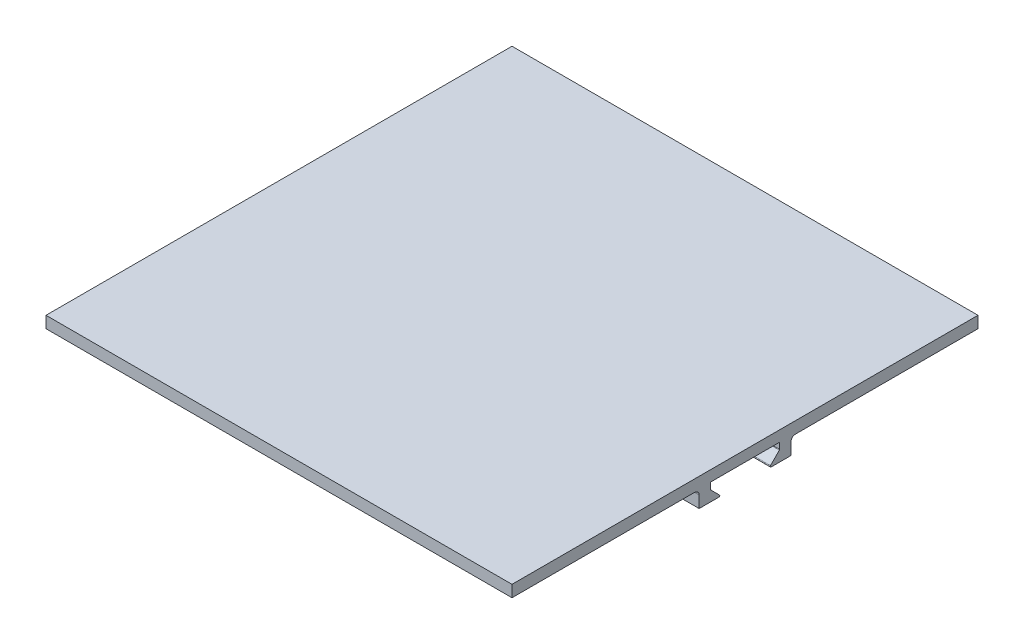
from build123d import *

# Parameters (mm, degrees)
SKETCH1_W          = 254
SKETCH1_H          = 254
BASE_DEPTH         = 6.35
SKETCH3_W          = 254
SKETCH3_H          = 50
KEY_MATERIAL_DEPTH = 8.89
KEY_SLIDE_DEPTH    = 285.119749578
KEY_CONTOURING_R   = 0.5
FILLET5_R          = 2.54


with BuildPart() as part:
    # Sketch1 → Base (new body)
    with BuildSketch(Plane(origin=(0, 0, 0), x_dir=(1, 0, 0), z_dir=(0, 1, 0))):
        Rectangle(SKETCH1_W, SKETCH1_H)
    extrude(amount=BASE_DEPTH)

    # Sketch3 → Key Material (add)
    with BuildSketch(Plane.XZ):
        Rectangle(SKETCH3_W, SKETCH3_H)
    extrude(amount=KEY_MATERIAL_DEPTH)

    # Sketch10 → Key Slide (cut, through all)
    with BuildSketch(Plane.ZY.offset(127)):
        Polygon((18.88975891, -3.047815367), (12.666574277, -9.271), (-12.649056457, -9.271), (-18.87224109, -3.047815367), (-18.87224109, 0.491), (18.88975891, 0.491), align=None)
    extrude(amount=-KEY_SLIDE_DEPTH, mode=Mode.SUBTRACT)

    # Key Contouring
    key_contouring_edges = [part.edges().sort_by_distance(p)[0] for p in [
        (0, -8.89, -13.030056457),
        (0, -8.89, 13.047574277),
        (0, -3.047815367, -18.87224109),
        (0, -3.047815367, 18.88975891),
    ]]
    fillet(key_contouring_edges, radius=KEY_CONTOURING_R)

    # Fillet5
    fillet5_edges = [part.edges().sort_by_distance(p)[0] for p in [
        (0, 0, -25),
        (0, 0, 25),
    ]]
    fillet(fillet5_edges, radius=FILLET5_R)


solid = part.part
